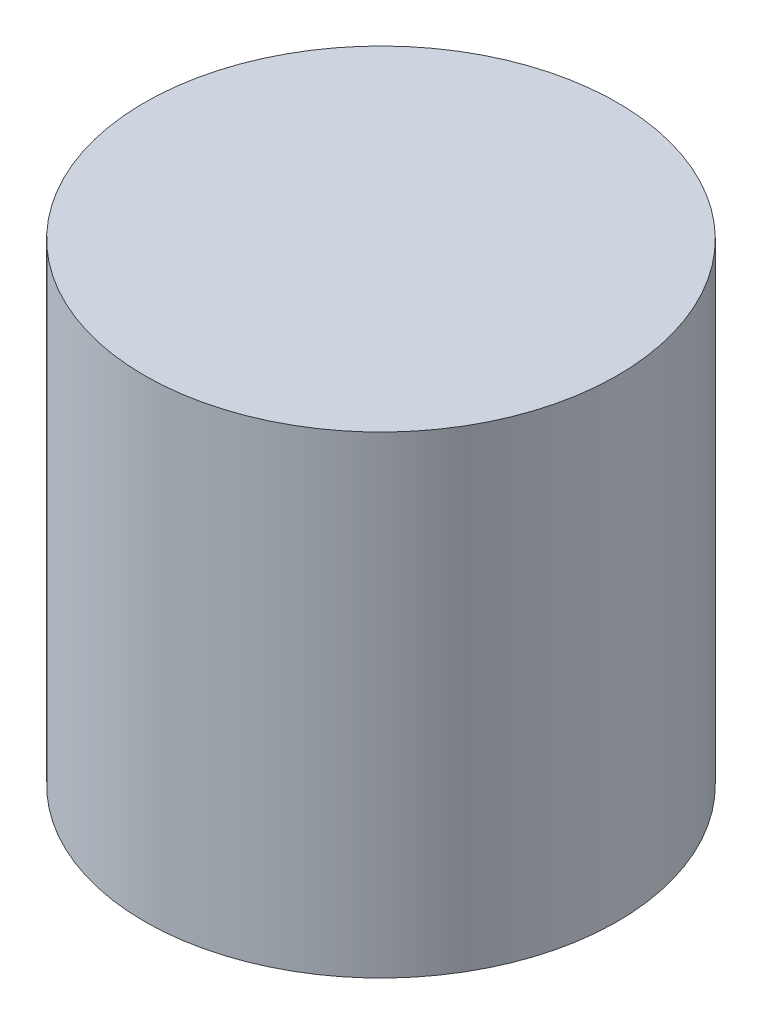
from build123d import *

# Parameters (mm, degrees)
SKETCH1_R           = 0.5
BOSS_EXTRUDE1_DEPTH = 1


with BuildPart() as part:
    # Sketch1 → Boss-Extrude1 (new body)
    with BuildSketch(Plane(origin=(0, 0, 0), x_dir=(1, 0, 0), z_dir=(0, 1, 0))):
        with Locations(Location((0, 0, 0), (0, 0, 270))):
            Circle(SKETCH1_R)
    extrude(amount=BOSS_EXTRUDE1_DEPTH)


solid = part.part
